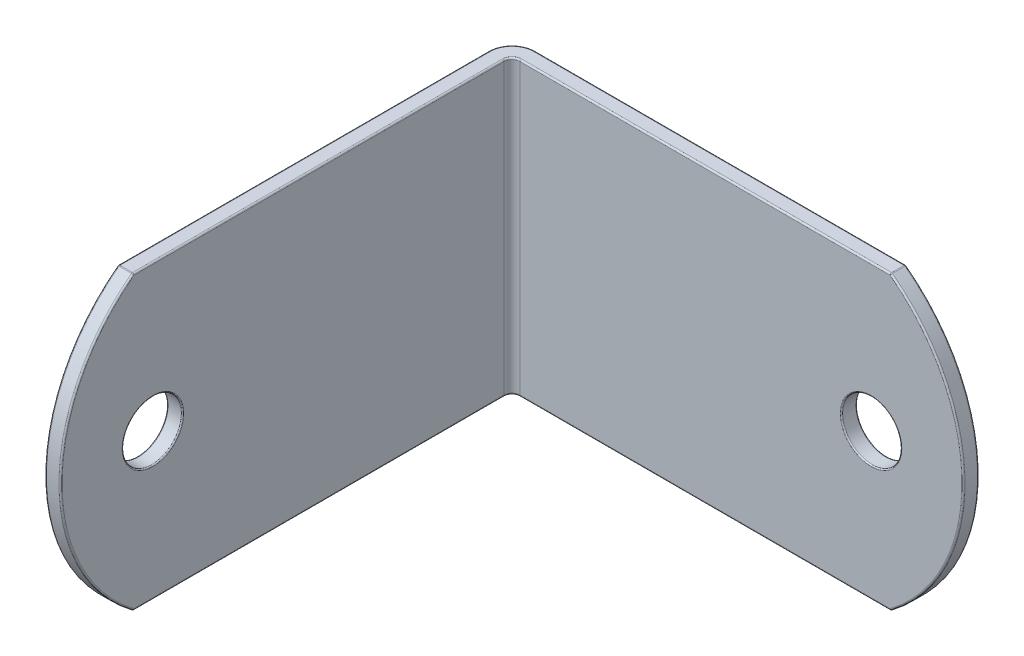
from build123d import *

# Parameters (mm, degrees)
BOSS_EXTRUDE1_START = 11.90625
BOSS_EXTRUDE1_DEPTH = 23.8125
SKETCH5_W           = 1.27
SKETCH5_H           = 2.413
SKETCH6_W           = 2.413
SKETCH6_H           = 1.27
CUT_EXTRUDE1_DEPTH  = 44.140586332
CUT_EXTRUDE2_DEPTH  = 44.140586332
FILLET1_R           = 0.127
FILLET2_R           = 0.09652


with BuildPart() as part:
    # Sketch4 → Boss-Extrude1 (new body)
    with BuildSketch(Plane(origin=(0, 0, 0), x_dir=(1, 0, 0), z_dir=(0, 1, 0)).offset(BOSS_EXTRUDE1_START)):
        with BuildLine():
            Line((-19.05, -19.05), (-17.78, -19.05))
            Line((-17.78, -19.05), (-17.78, 17.145))
            ThreePointArc((-17.78, 17.145), (-17.594012806, 17.594012806), (-17.145, 17.78))
            Line((-17.145, 17.78), (19.05, 17.78))
            Line((19.05, 17.78), (19.05, 19.05))
            Line((19.05, 19.05), (-17.145, 19.05))
            ThreePointArc((-17.145, 19.05), (-18.492038418, 18.492038418), (-19.05, 17.145))
            Line((-19.05, 17.145), (-19.05, -19.05))
        make_face()
    extrude(amount=-BOSS_EXTRUDE1_DEPTH)

    # Sketch5 → Cut-Revolve1 (revolve, cut)
    with BuildSketch(Plane(origin=(0, 0, 0), x_dir=(1, 0, 0), z_dir=(0, 1, 0)), mode=Mode.PRIVATE) as cut_revolve1_sk:
        with Locations((-18.415, -10.302875)):
            Rectangle(SKETCH5_W, SKETCH5_H)
    revolve(cut_revolve1_sk.sketch.rotate(Axis((-19.05, 0, 11.509375), (1, 0, 0)), 180), axis=Axis((-19.05, 0, 11.509375), (1, 0, 0)), mode=Mode.SUBTRACT)

    # Sketch6 → Cut-Revolve2 (revolve, cut)
    with BuildSketch(Plane(origin=(0, 0, 0), x_dir=(1, 0, 0), z_dir=(0, 1, 0)), mode=Mode.PRIVATE) as cut_revolve2_sk:
        with Locations((12.715875, 18.415)):
            Rectangle(SKETCH6_W, SKETCH6_H)
    revolve(cut_revolve2_sk.sketch.rotate(Axis((11.509375, 0, -19.05), (0, 0, 1)), 180), axis=Axis((11.509375, 0, -19.05), (0, 0, 1)), mode=Mode.SUBTRACT)

    # Sketch7 → Cut-Extrude1 (cut, through all)
    with BuildSketch(Plane(origin=(-17.78, 0, 0), x_dir=(0, 0, -1), z_dir=(1, 0, 0))):
        with BuildLine():
            ThreePointArc((-19.05, 0), (-17.478779679, 6.655796089), (-13.096875, 11.90625))
            Line((-13.096875, 11.90625), (-19.05, 11.90625))
            Line((-19.05, 11.90625), (-19.05, 0))
        make_face()
        with BuildLine():
            ThreePointArc((-13.096875, -11.90625), (-17.478779679, -6.655796089), (-19.05, 0))
            Line((-19.05, 0), (-19.05, -11.90625))
            Line((-19.05, -11.90625), (-13.096875, -11.90625))
        make_face()
    extrude(amount=-CUT_EXTRUDE1_DEPTH, mode=Mode.SUBTRACT)

    # Sketch8 → Cut-Extrude2 (cut, through all)
    with BuildSketch(Plane.XY.offset(-17.78)):
        with BuildLine():
            Line((19.05, 11.90625), (13.096875, 11.90625))
            ThreePointArc((13.096875, 11.90625), (17.478779679, 6.655796089), (19.05, 0))
            Line((19.05, 0), (19.05, 11.90625))
        make_face()
        with BuildLine():
            Line((19.05, -11.90625), (19.05, 0))
            ThreePointArc((19.05, 0), (17.478779679, -6.655796089), (13.096875, -11.90625))
            Line((13.096875, -11.90625), (19.05, -11.90625))
        make_face()
    extrude(amount=-CUT_EXTRUDE2_DEPTH, mode=Mode.SUBTRACT)

    # Fillet1
    fillet1_edges = [part.edges().sort_by_distance(p)[0] for p in [
        (-19.05, 11.90625, -2.0240625),
        (-17.594012806, -11.90625, -17.594012806),
        (-2.0240625, -11.90625, -17.78),
        (-18.492038418, -11.90625, -18.492038418),
        (-17.78, 11.90625, -2.0240625),
        (-17.78, 0, 19.05),
        (-18.415, 11.90625, 13.096875),
        (-19.05, 0, 19.05),
        (-19.05, -11.90625, -2.0240625),
        (-17.78, -11.90625, -2.0240625),
        (-18.415, -11.90625, 13.096875),
        (-2.0240625, 11.90625, -19.05),
        (13.096875, 11.90625, -18.415),
        (19.05, 0, -19.05),
        (19.05, 0, -17.78),
        (-2.0240625, -11.90625, -19.05),
        (13.096875, -11.90625, -18.415),
        (-18.492038418, 11.90625, -18.492038418),
        (-2.0240625, 11.90625, -17.78),
        (-17.594012806, 11.90625, -17.594012806),
    ]]
    fillet(fillet1_edges, radius=FILLET1_R)

    # Fillet2
    fillet2_edges = [part.edges().sort_by_distance(p)[0] for p in [
        (-19.05, 0, 9.096375),
        (-17.78, 0, 9.096375),
        (13.922375, 0, -17.78),
        (13.922375, 0, -19.05),
    ]]
    fillet(fillet2_edges, radius=FILLET2_R)


solid = part.part
